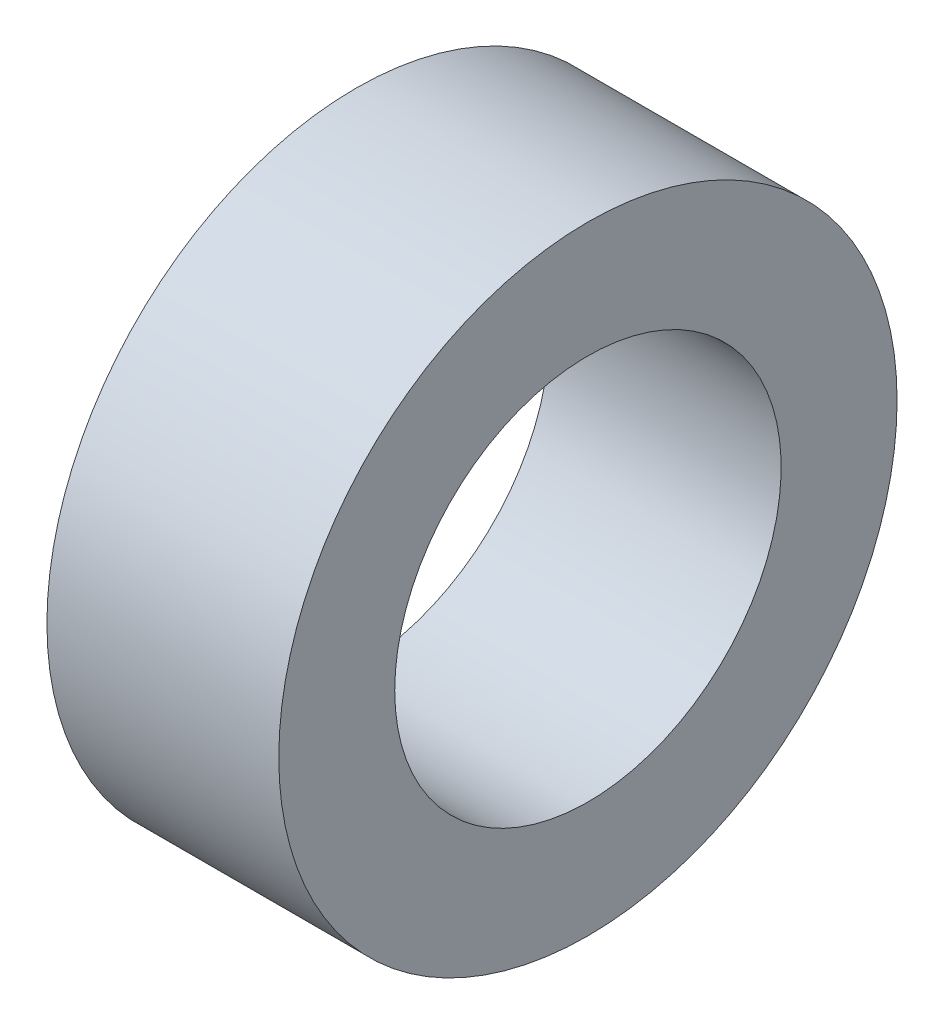
from build123d import *

# Parameters (mm, degrees)
SKETCH1_W = 6
SKETCH1_H = 3


with BuildPart() as part:
    # Sketch1 → Revolve1 (revolve)
    with BuildSketch(Plane.XY, mode=Mode.PRIVATE) as revolve1_sk:
        with Locations((3, 6.5)):
            Rectangle(SKETCH1_W, SKETCH1_H)
    revolve(revolve1_sk.sketch.rotate(Axis((0, 0, 0), (1, 0, 0)), 90), axis=Axis((0, 0, 0), (1, 0, 0)))


solid = part.part
